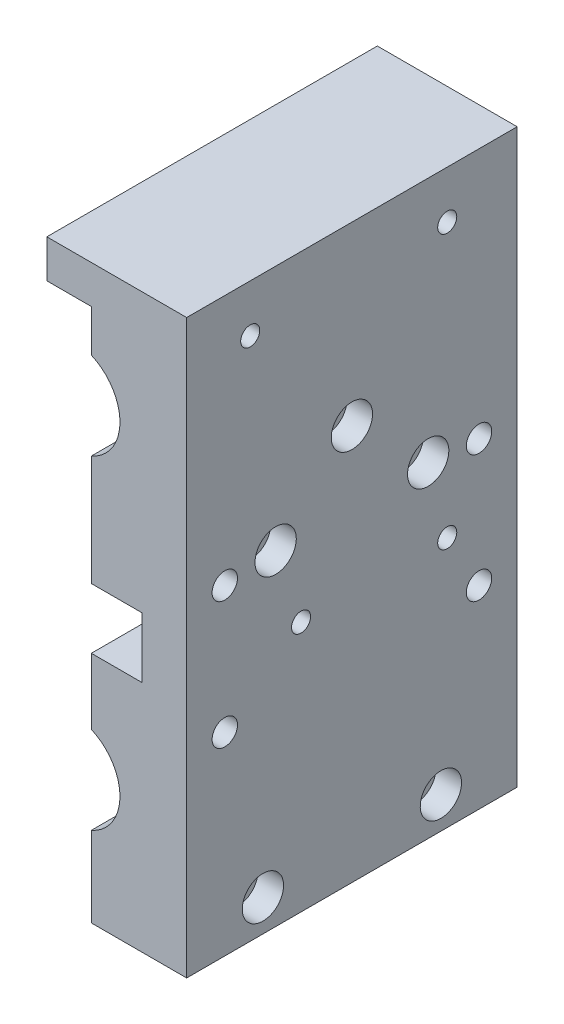
from build123d import *

# Parameters (mm, degrees)
BOSS_EXTRUDE1_DEPTH          = 52
SKETCH2_R                    = 2
CUT_EXTRUDE1_DEPTH           = 100.924971854
ESQUISSE1_R                  = 1.5
ENL_V_MAT_EXTRU_1_DEPTH      = 102.212647431
ENL_V_MAT_EXTRU_2_DEPTH      = 100.924971854
ENL_V_MAT_EXTRU_2_DEPTH_BACK = 3
ESQUISSE2_R                  = 2.5
ESQUISSE3_R                  = 3.25
ENL_V_MAT_EXTRU_3_DEPTH      = 4
ESQUISSE4_R                  = 2
ENL_V_MAT_EXTRU_4_DEPTH      = 102.212647431
ESQUISSE4_3_R                = 3.25
ESQUISSE4_3_R_2              = 2
ENL_V_MAT_EXTRU_5_DEPTH      = 4
ESQUISSE5_R                  = 2
ENL_V_MAT_EXTRU_6_DEPTH      = 100.924971854
ESQUISSE6_R                  = 2
ENL_V_MAT_EXTRU_7_DEPTH      = 102.212647431
ESQUISSE7_R                  = 3.25
ENL_V_MAT_EXTRU_8_DEPTH      = 4
ESQUISSE8_R                  = 7.5
ENL_V_MAT_EXTRU_9_DEPTH      = 100.924971854


with BuildPart() as part:
    # Sketch1 → Boss-Extrude1 (new body)
    with BuildSketch(Plane.XY):
        Polygon((0, 0), (0, -37.75), (8, -37.75), (8, -47.25), (0, -47.25), (0, -84), (15, -84), (15, 6), (-7, 6), (-7, 0), align=None)
    extrude(amount=BOSS_EXTRUDE1_DEPTH)

    # Sketch2 → Cut-Extrude1 (cut, through all)
    with BuildSketch(Plane.ZY):
        with Locations((26, -21.75)):
            Circle(SKETCH2_R)
        with Locations((38, -32.75)):
            Circle(SKETCH2_R)
        with Locations((14, -32.75)):
            Circle(SKETCH2_R)
    extrude(amount=-CUT_EXTRUDE1_DEPTH, mode=Mode.SUBTRACT)

    # Esquisse1 → Enlèv. mat.-Extru.1 (cut, through all)
    with BuildSketch(Plane(origin=(15, 0, 0), x_dir=(0, 0, -1), z_dir=(1, 0, 0))):
        with Locations((-42, -1.5)):
            Circle(ESQUISSE1_R)
        with Locations((-11, -1.5)):
            Circle(ESQUISSE1_R)
        with Locations((-34, -44.5)):
            Circle(ESQUISSE1_R)
        with Locations((-11, -44.5)):
            Circle(ESQUISSE1_R)
    extrude(amount=-ENL_V_MAT_EXTRU_1_DEPTH, mode=Mode.SUBTRACT)

    # Esquisse2 → Enlèv. mat.-Extru.2 (cut, two sides: drawn at the far end of the back side and taken through both)
    with BuildSketch(Plane.ZY.offset(-ENL_V_MAT_EXTRU_2_DEPTH_BACK)):
        with Locations((42, -1.5)):
            Circle(ESQUISSE2_R)
        with Locations((11, -1.5)):
            Circle(ESQUISSE2_R)
    extrude(amount=ENL_V_MAT_EXTRU_2_DEPTH + ENL_V_MAT_EXTRU_2_DEPTH_BACK, mode=Mode.SUBTRACT)

    # Esquisse3 → Enlèv. mat.-Extru.3 (cut)
    with BuildSketch(Plane(origin=(15, 0, 0), x_dir=(0, 0, -1), z_dir=(1, 0, 0))):
        with Locations((-26, -21.75)):
            Circle(ESQUISSE3_R)
        with Locations((-14, -32.75)):
            Circle(ESQUISSE3_R)
        with Locations((-38, -32.75)):
            Circle(ESQUISSE3_R)
    extrude(amount=-ENL_V_MAT_EXTRU_3_DEPTH, mode=Mode.SUBTRACT)

    # Esquisse4 → Enlèv. mat.-Extru.4 (cut, through all)
    with BuildSketch(Plane(origin=(15, 0, 0), x_dir=(0, 0, -1), z_dir=(1, 0, 0))):
        with Locations((-40, -79)):
            Circle(ESQUISSE4_R)
        with Locations((-12, -79)):
            Circle(ESQUISSE4_R)
    extrude(amount=-ENL_V_MAT_EXTRU_4_DEPTH, mode=Mode.SUBTRACT)

    # Esquisse4<3> → Enlèv. mat.-Extru.5 (cut)
    # profile 1 of 2: a face of its own
    with BuildSketch(Plane(origin=(15, 0, 0), x_dir=(0, 0, -1), z_dir=(1, 0, 0))):
        with Locations((-12, -79)):
            Circle(ESQUISSE4_3_R)
        with Locations((-12, -79)):
            Circle(ESQUISSE4_3_R_2, mode=Mode.SUBTRACT)
    # profile 2 of 2: a face of its own
    with BuildSketch(Plane(origin=(15, 0, 0), x_dir=(0, 0, -1), z_dir=(1, 0, 0))):
        with Locations((-40, -79)):
            Circle(ESQUISSE4_3_R)
        with Locations((-40, -79)):
            Circle(ESQUISSE4_3_R_2, mode=Mode.SUBTRACT)
    extrude(amount=-ENL_V_MAT_EXTRU_5_DEPTH, mode=Mode.SUBTRACT)

    # Esquisse5 → Enlèv. mat.-Extru.6 (cut, through all)
    with BuildSketch(Plane.ZY):
        with Locations((46, -33.5)):
            Circle(ESQUISSE5_R)
        with Locations((6, -33.5)):
            Circle(ESQUISSE5_R)
    extrude(amount=-ENL_V_MAT_EXTRU_6_DEPTH, mode=Mode.SUBTRACT)

    # Esquisse6 → Enlèv. mat.-Extru.7 (cut, through all)
    with BuildSketch(Plane(origin=(15, 0, 0), x_dir=(0, 0, -1), z_dir=(1, 0, 0))):
        with Locations((-6, -53.5)):
            Circle(ESQUISSE6_R)
        with Locations((-46, -53.5)):
            Circle(ESQUISSE6_R)
    extrude(amount=-ENL_V_MAT_EXTRU_7_DEPTH, mode=Mode.SUBTRACT)

    # Esquisse7 → Enlèv. mat.-Extru.8 (cut)
    with BuildSketch(Plane.ZY):
        with Locations((46, -53.5)):
            Circle(ESQUISSE7_R)
        with Locations((6, -53.5)):
            Circle(ESQUISSE7_R)
    extrude(amount=-ENL_V_MAT_EXTRU_8_DEPTH, mode=Mode.SUBTRACT)

    # Esquisse8 → Enlèv. mat.-Extru.9 (cut, through all)
    with BuildSketch(Plane(origin=(0, 0, 0), x_dir=(-1, 0, 0), z_dir=(0, 0, -1))):
        with Locations((3, -13.5)):
            Circle(ESQUISSE8_R)
        with Locations((3, -64.5)):
            Circle(ESQUISSE8_R)
    extrude(amount=-ENL_V_MAT_EXTRU_9_DEPTH, mode=Mode.SUBTRACT)


solid = part.part
